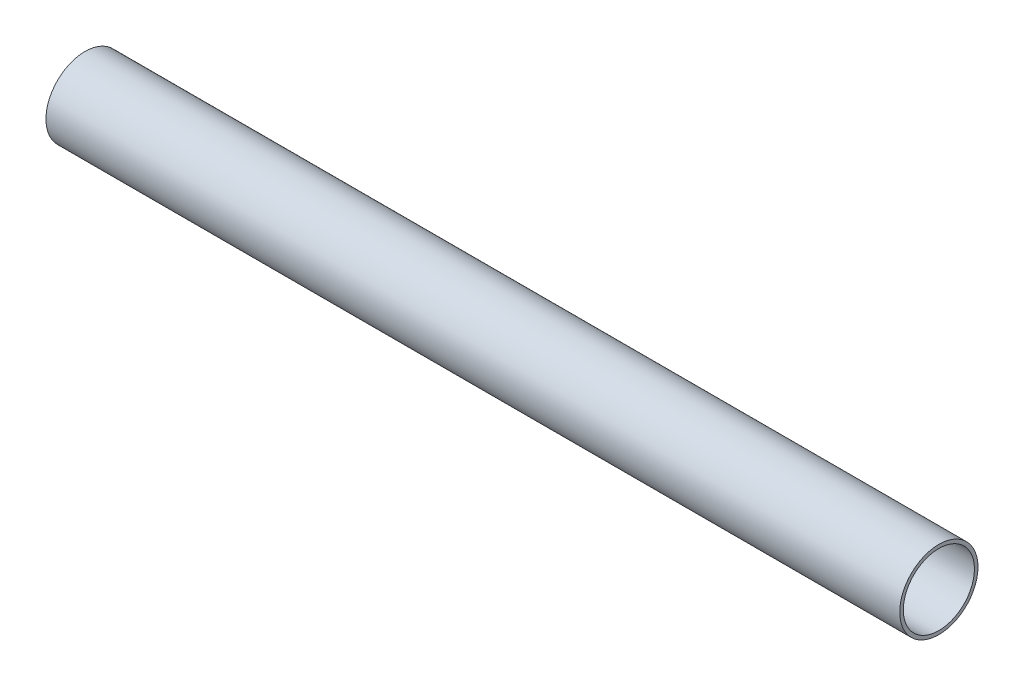
from build123d import *

# Parameters (mm, degrees)
SKETCH1_R           = 34.925
SKETCH1_R_2         = 31.75
BOSS_EXTRUDE1_DEPTH = 762


with BuildPart() as part:
    # Sketch1 → Boss-Extrude1 (new body)
    with BuildSketch(Plane(origin=(0, 0, 0), x_dir=(0, 0, -1), z_dir=(1, 0, 0))):
        Circle(SKETCH1_R)
        Circle(SKETCH1_R_2, mode=Mode.SUBTRACT)
    extrude(amount=BOSS_EXTRUDE1_DEPTH)


solid = part.part
